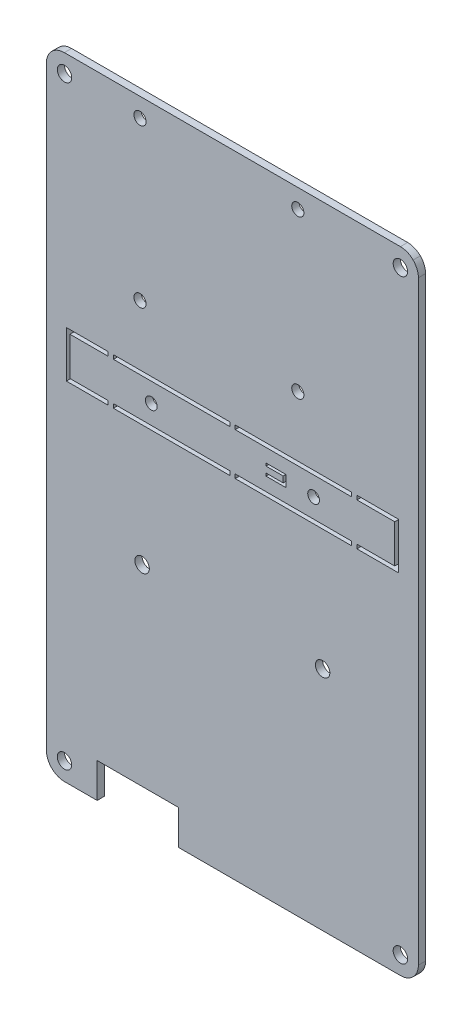
from build123d import *

# Parameters (mm, degrees)
MODEL_R             = 1.3
MODEL_R_2           = 1.35
MODEL_R_3           = 1.6
MODEL_W             = 25.800871102
MODEL_H             = 0.899853509
MODEL_W_2           = 25.800870102
MODEL_H_2           = 0.900030515
BOSS_EXTRUDE1_DEPTH = 1.6


with BuildPart() as part:
    # Model → Boss-Extrude1 (new body)
    with BuildSketch(Plane.XY):
        with BuildLine():
            Line((70.002361624, -162.304686543), (88.002880425, -162.304686543))
            Line((88.002880425, -162.304686543), (88.002880425, -169.986796467))
            Line((88.002880425, -169.986796467), (137.258712697, -169.986796467))
            add(Edge.make_bspline(
                [(137.258712697, -169.986796467), (138.316181375, -169.986784466), (139.330341633, -169.566711691), (140.078087155, -168.81897017)],
                knots=[0, 0, 0, 0, 1, 1, 1, 1], degree=3))
            add(Edge.make_bspline(
                [(140.078087155, -168.81897017), (140.825832676, -168.071228648), (141.245910452, -167.057070391), (141.246087457, -165.999601713)],
                knots=[0, 0, 0, 0, 1, 1, 1, 1], degree=3))
            Line((141.246087457, -165.999601713), (141.246264463, -33.963752791))
            add(Edge.make_bspline(
                [(141.246264463, -33.963752791), (141.246219462, -32.906240112), (140.826140686, -31.892031852), (140.078372164, -31.14425033)],
                knots=[0, 0, 0, 0, 1, 1, 1, 1], degree=3))
            add(Edge.make_bspline(
                [(140.078372164, -31.14425033), (139.330603642, -30.396469808), (138.316402383, -29.976373031), (137.258889703, -29.976735043)],
                knots=[0, 0, 0, 0, 1, 1, 1, 1], degree=3))
            Line((137.258889703, -29.976735043), (62.730494654, -29.976735043))
            add(Edge.make_bspline(
                [(62.730494654, -29.976735043), (61.673022976, -29.976726043), (60.658862718, -30.396804818), (59.911117197, -31.14455134)],
                knots=[0, 0, 0, 0, 1, 1, 1, 1], degree=3))
            add(Edge.make_bspline(
                [(59.911117197, -31.14455134), (59.163396148, -31.892320333), (58.743351208, -32.906494777), (58.743388403, -33.963966454)],
                knots=[0, 0, 0, 0, 1, 1, 1, 1], degree=3))
            Line((58.743388403, -33.963966454), (58.743211397, -165.999601713))
            add(Edge.make_bspline(
                [(58.743211397, -165.999601713), (58.743209397, -168.201763929), (60.52841994, -169.986947472), (62.730583157, -169.986616461)],
                knots=[0, 0, 0, 0, 1, 1, 1, 1], degree=3))
            Line((62.730583157, -169.986616461), (70.002361624, -169.986796467))
            Line((70.002361624, -169.986796467), (70.002361624, -162.304686543))
        make_face()
        with Locations((118.003980767, -87.700241)):
            Circle(MODEL_R, mode=Mode.SUBTRACT)
        with Locations((82.00276616, -87.700241)):
            Circle(MODEL_R, mode=Mode.SUBTRACT)
        with Locations((114.503861986, -69.193633103)):
            Circle(MODEL_R_2, mode=Mode.SUBTRACT)
        with Locations((79.502681173, -69.193633103)):
            Circle(MODEL_R_2, mode=Mode.SUBTRACT)
        with Locations((79.502681173, -34.192456291)):
            Circle(MODEL_R_2, mode=Mode.SUBTRACT)
        with Locations((114.503861986, -34.192456291)):
            Circle(MODEL_R_2, mode=Mode.SUBTRACT)
        with Locations((62.752116863, -34.000356992)):
            Circle(MODEL_R_3, mode=Mode.SUBTRACT)
        with Locations((137.254631064, -34.000356992)):
            Circle(MODEL_R_3, mode=Mode.SUBTRACT)
        with Locations((137.254631064, -166.004811883)):
            Circle(MODEL_R_3, mode=Mode.SUBTRACT)
        with Locations((62.752116863, -166.004811883)):
            Circle(MODEL_R_3, mode=Mode.SUBTRACT)
        with Locations((79.970369511, -119.70654813)):
            Circle(MODEL_R_3, mode=Mode.SUBTRACT)
        with Locations((120.007632474, -119.70654813)):
            Circle(MODEL_R_3, mode=Mode.SUBTRACT)
        Polygon((72.414426725, -82.550246114), (63.175439746, -82.550246114), (63.175439746, -92.850417893), (72.414426725, -92.850417893), (72.414426725, -91.950387378), (63.975466981, -91.950387378), (63.975466981, -83.450099623), (72.414426725, -83.450099623), align=None, mode=Mode.SUBTRACT)
        with Locations((86.514902629, -83.000172869)):
            Rectangle(MODEL_W, MODEL_H, mode=Mode.SUBTRACT)
        with Locations((113.515809584, -83.000172869)):
            Rectangle(MODEL_W_2, MODEL_H, mode=Mode.SUBTRACT)
        with Locations((86.514902629, -92.400402636)):
            Rectangle(MODEL_W, MODEL_H_2, mode=Mode.SUBTRACT)
        with Locations((113.515809584, -92.400402636)):
            Rectangle(MODEL_W_2, MODEL_H_2, mode=Mode.SUBTRACT)
        Polygon((127.616285988, -91.950387378), (127.616285988, -92.850417893), (136.80289525, -92.850417893), (136.80289525, -82.550246114), (127.616285988, -82.550246114), (127.616285988, -83.450099623), (136.002869014, -83.450099623), (136.002869014, -91.950387378), align=None, mode=Mode.SUBTRACT)
        Polygon((107.453624783, -86.436359553), (111.85377408, -86.436359553), (111.85377408, -88.964126448), (107.453624783, -88.964126448), (107.453624783, -88.364106771), (111.253753403, -88.364106771), (111.253753403, -87.03638023), (107.453624783, -87.03638023), align=None, mode=Mode.SUBTRACT)
    extrude(amount=BOSS_EXTRUDE1_DEPTH)


solid = part.part
